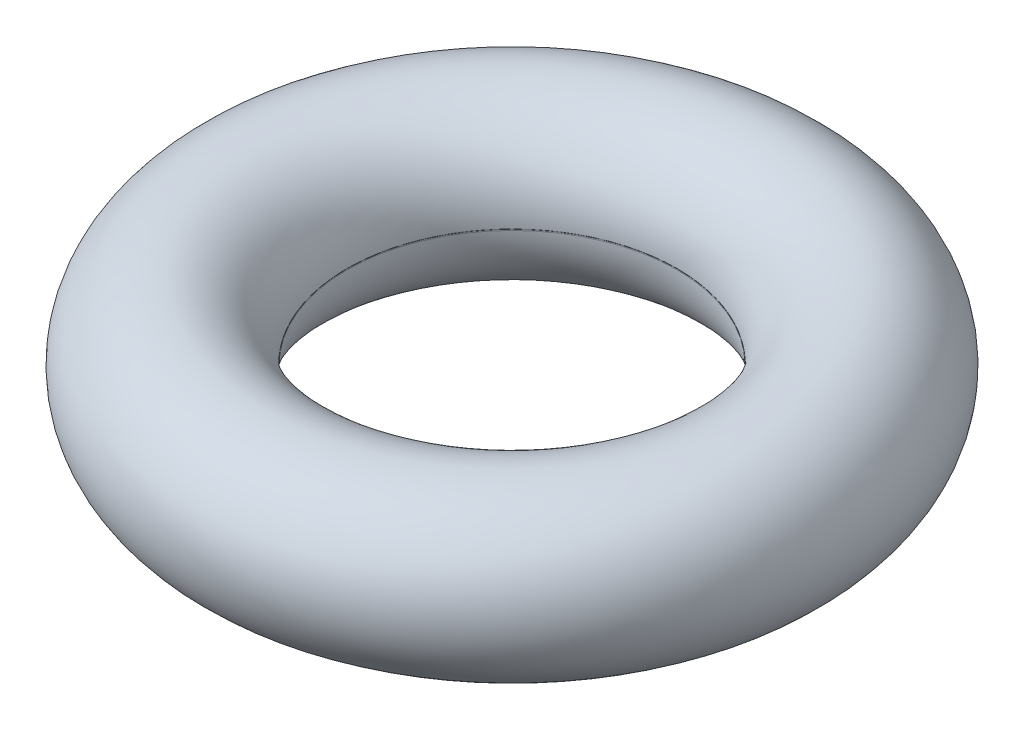
from build123d import *

# Parameters (mm, degrees)
ESBO_O1_R                = 0.75
ESBO_O2_R                = 1.505
ESBO_O2_R_2              = 1.5
RESSALTO_EXTRUS_O1_DEPTH = 0.01


with BuildPart() as part:
    # Esboço1 → Revolução1 (revolve)
    with BuildSketch(Plane.XY, mode=Mode.PRIVATE) as revolu_o1_sk:
        with Locations((2.25, 0)):
            Circle(ESBO_O1_R)
    revolve(revolu_o1_sk.sketch.rotate(Axis((0, 0, 0), (0, 1, 0)), 90), axis=Axis((0, 0, 0), (0, 1, 0)))


with BuildPart() as body_2:
    # Esboço2 → Ressalto-extrusão1 (new body)
    with BuildSketch(Plane(origin=(0, 0, 0), x_dir=(1, 0, 0), z_dir=(0, 1, 0))):
        with Locations(Location((0, 0, 0), (0, 0, 90))):
            Circle(ESBO_O2_R)
        with Locations(Location((0, 0, 0), (0, 0, 90))):
            Circle(ESBO_O2_R_2, mode=Mode.SUBTRACT)
    extrude(amount=RESSALTO_EXTRUS_O1_DEPTH)


solid = Compound([part.part, body_2.part])
